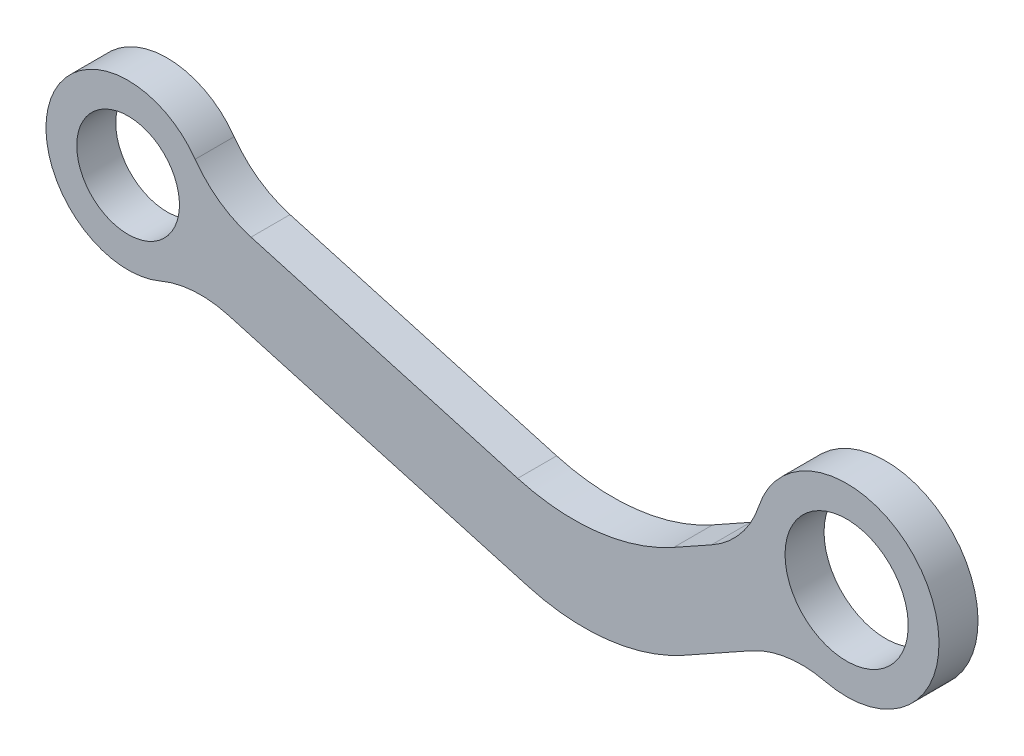
from build123d import *

# Parameters (mm, degrees)
SKETCH_1_R        = 4.5
SKETCH_1_R_2      = 3
EXTRUDE_1_DEPTH   = 1.9
SKETCH_1_R_3      = 4
SKETCH_1_R_4      = 2.5
EXTRUDE_1_2_DEPTH = 1.9
EXTRUDE_START     = -1.9
EXTRUDE_2_DEPTH   = 1.9
FILLET_1_R        = 10
FILLET_2_R        = 5


with BuildPart() as part:
    # ｽｹｯﾁ1 → ﾎﾞｽ - 押し出し1 (new body)
    with BuildSketch(Plane.XY):
        with Locations(Location((35, 0, 0), (0, 0, 180))):
            Circle(SKETCH_1_R)
        with Locations(Location((35, 0, 0), (0, 0, 180))):
            Circle(SKETCH_1_R_2, mode=Mode.SUBTRACT)
    extrude(amount=EXTRUDE_1_DEPTH)



with BuildPart() as body_2:
    # ｽｹｯﾁ1 → Extrude 1 2 (new body)
    with BuildSketch(Plane.XY):
        with Locations(Location((0, 0, 0), (0, 0, 180))):
            Circle(SKETCH_1_R_3)
        with Locations(Location((0, 0, 0), (0, 0, 180))):
            Circle(SKETCH_1_R_4, mode=Mode.SUBTRACT)
    extrude(amount=EXTRUDE_1_2_DEPTH)


with BuildPart() as part_1:
    add(part.part)

    add(body_2.part)  # ﾎﾞｽ - 押し出し2 merges body 2
    # ｽｹｯﾁ3 → ﾎﾞｽ - 押し出し2 (add)
    with BuildSketch(Plane.XY.offset(1.9).offset(EXTRUDE_START)):
        with BuildLine():
            Line((30.505314037, -0.218627753), (22.960861135, -4.430337969))
            Line((22.960861135, -4.430337969), (3.878251034, 0.979371696))
            ThreePointArc((3.878251034, 0.979371696), (3.848349766, -1.090964748), (2.787286286, -2.868978069))
            Line((2.787286286, -2.868978069), (23.463935052, -8.730580129))
            Line((23.463935052, -8.730580129), (32.455079681, -3.71125054))
            ThreePointArc((32.455079681, -3.71125054), (31.070799365, -2.19348635), (30.505314037, -0.218627753))
        make_face()
    extrude(amount=EXTRUDE_2_DEPTH)

    # ﾌｨﾚｯﾄ1
    fillet_1_edges = [part_1.edges().sort_by_distance(p)[0] for p in [
        (22.960861135, -4.430337969, 0.95),
        (23.463935052, -8.730580129, 0.95),
    ]]
    fillet(fillet_1_edges, radius=FILLET_1_R)

    # ﾌｨﾚｯﾄ2
    fillet_2_edges = [part_1.edges().sort_by_distance(p)[0] for p in [
        (3.878251034, 0.979371696, 0.95),
        (30.505314037, -0.218627753, 0.95),
        (32.455079681, -3.71125054, 0.95),
        (2.787286286, -2.868978069, 0.95),
    ]]
    fillet(fillet_2_edges, radius=FILLET_2_R)


solid = part_1.part
